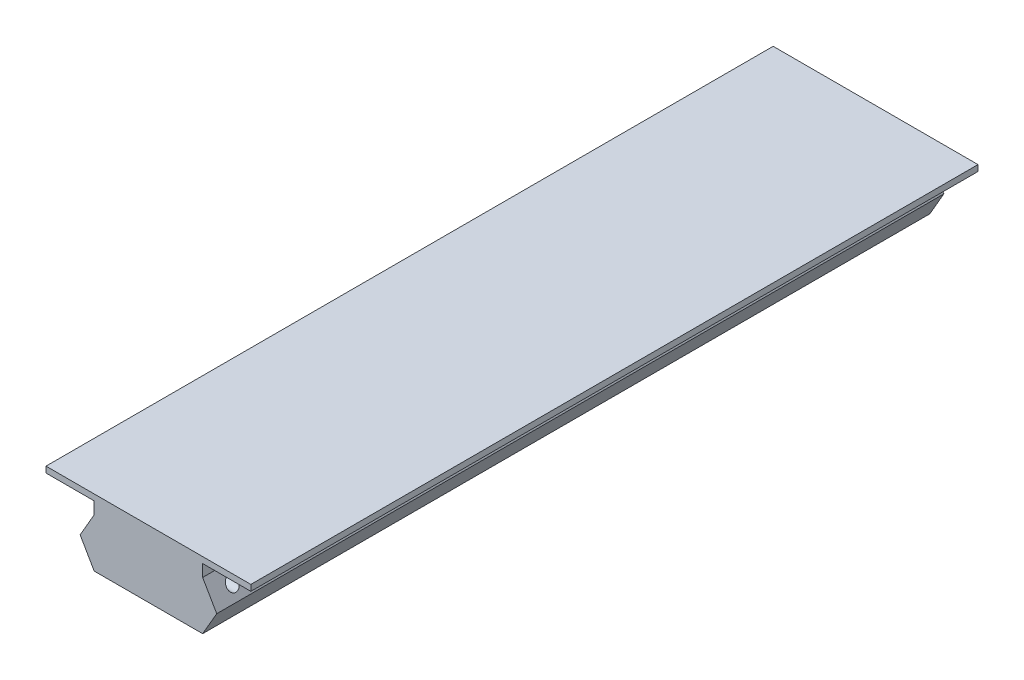
from build123d import *

# Parameters (mm, degrees)
BOSS_EXTRUDE1_DEPTH = 120.69
SKETCH2_R           = 1
CUT_EXTRUDE1_DEPTH  = 123.482966683
LPATTERN1_COUNT     = 32
LPATTERN1_PITCH     = 3.71


with BuildPart() as part:
    # Sketch1 → Boss-Extrude1 (new body)
    with BuildSketch(Plane.XY):
        Polygon((9.693000417, 0), (-8.306999583, 0), (-10.641999583, 4.044338636), (-8.306999583, 8.088677271), (-8.306999583, 10.088677271), (-16.306999583, 10.088677271), (-16.306999583, 11.088677271), (17.693000417, 11.088677271), (17.693000417, 10.088677271), (9.693000417, 10.088677271), (9.693000417, 8.088677271), (12.028000417, 4.044338636), align=None)
    extrude(amount=-BOSS_EXTRUDE1_DEPTH)

    # Sketch2 → Cut-Extrude1 (cut, symmetric)
    with BuildSketch(Plane(origin=(0, 0, 0), x_dir=(0, 0, -1), z_dir=(1, 0, 0))):
        with Locations(Location((3.71, 5.988677271, 0), (0, 0, 90))):
            Circle(SKETCH2_R)
    cut_extrude1 = extrude(amount=CUT_EXTRUDE1_DEPTH, both=True, mode=Mode.SUBTRACT)

    # LPattern1: Cut-Extrude1 ×32
    with Locations(*[(0, 0, -i * LPATTERN1_PITCH) for i in range(1, LPATTERN1_COUNT)]):
        add(cut_extrude1, mode=Mode.SUBTRACT)


solid = part.part
